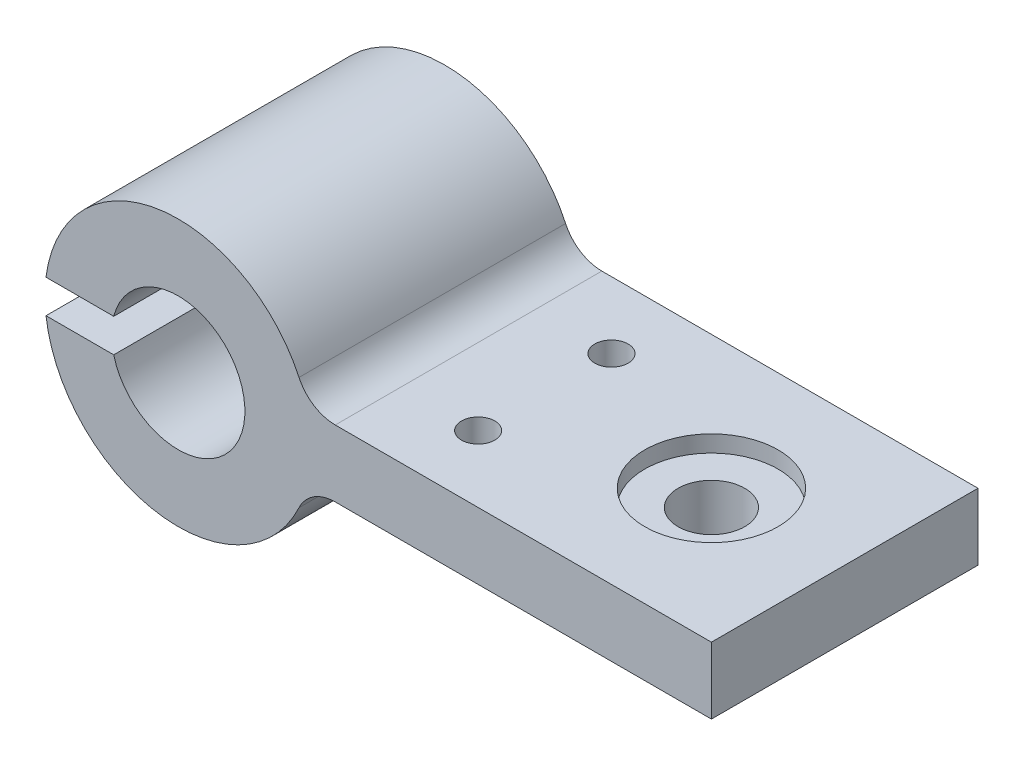
from build123d import *

# Parameters (mm, degrees)
BOSS_EXTRUDE2_DEPTH     = 50.8
SKETCH2_R               = 12.7
CUT_EXTRUDE1_DEPTH      = 3.175
SKETCH3_R               = 6.35
CUT_EXTRUDE2_DEPTH      = 118.131253835
CUT_EXTRUDE3_DEPTH      = 117.397422652
CUT_EXTRUDE3_DEPTH_BACK = 117.397422652
SKETCH5_R               = 3.175
CUT_EXTRUDE4_DEPTH      = 118.946015193


with BuildPart() as part:
    # Sketch1 → Boss-Extrude2 (new body)
    with BuildSketch(Plane.XY):
        with BuildLine():
            Line((29.919216233, -6.35), (24.593444248, -6.35))
            ThreePointArc((24.593444248, -6.35), (23.905382985, -8.584443158), (23.014781645, -10.746154003))
            ThreePointArc((23.014781645, -10.746154003), (25.826619655, -7.542321317), (29.919216233, -6.35))
        make_face()
        with BuildLine():
            ThreePointArc((23.01478179, 10.746153692), (23.905383043, 8.584442996), (24.593444248, 6.35))
            Line((24.593444248, 6.35), (29.919216228, 6.35))
            ThreePointArc((29.919216228, 6.35), (25.826619797, 7.542321227), (23.01478179, 10.746153692))
        make_face()
        with BuildLine():
            Line((29.919216228, 6.35), (24.593444248, 6.35))
            ThreePointArc((24.593444248, 6.35), (25.197554285, 3.200509029), (25.4, 0))
            ThreePointArc((25.4, 0), (25.197554285, -3.200509029), (24.593444248, -6.35))
            Line((24.593444248, -6.35), (29.919216233, -6.35))
            Line((29.919216233, -6.35), (101.6, -6.35))
            Line((101.6, -6.35), (101.6, 6.35))
            Line((101.6, 6.35), (29.919216228, 6.35))
        make_face()
        with BuildLine():
            Line((24.593444248, -6.35), (0, -6.35))
            Line((0, -6.35), (0, -25.4))
            ThreePointArc((0, -25.4), (13.641988278, -21.425595811), (23.014781645, -10.746154003))
            ThreePointArc((23.014781645, -10.746154003), (23.905382985, -8.584443158), (24.593444248, -6.35))
        make_face()
        with BuildLine():
            Line((24.593444248, 6.35), (0, 6.35))
            Line((0, 6.35), (0, -6.35))
            Line((0, -6.35), (24.593444248, -6.35))
            ThreePointArc((24.593444248, -6.35), (25.197554285, -3.200509029), (25.4, 0))
            ThreePointArc((25.4, 0), (25.197554285, 3.200509029), (24.593444248, 6.35))
        make_face()
        with BuildLine():
            Line((0, 25.4), (0, 6.35))
            Line((0, 6.35), (24.593444248, 6.35))
            ThreePointArc((24.593444248, 6.35), (23.905383043, 8.584442996), (23.01478179, 10.746153692))
            ThreePointArc((23.01478179, 10.746153692), (13.641988422, 21.425595718), (0, 25.4))
        make_face()
        with BuildLine():
            Line((0, -6.35), (0, 6.35))
            Line((0, 6.35), (0, 25.4))
            ThreePointArc((0, 25.4), (-25.4, 0), (0, -25.4))
            Line((0, -25.4), (0, -6.35))
        make_face()
    extrude(amount=BOSS_EXTRUDE2_DEPTH)

    # Sketch2 → Cut-Extrude1 (cut)
    with BuildSketch(Plane(origin=(0, 6.35, 0), x_dir=(1, 0, 0), z_dir=(0, 1, 0))):
        with Locations(Location((76.2, -25.4, 0), (0, 0, 270))):
            Circle(SKETCH2_R)
    extrude(amount=-CUT_EXTRUDE1_DEPTH, mode=Mode.SUBTRACT)

    # Sketch3 → Cut-Extrude2 (cut, through all)
    with BuildSketch(Plane(origin=(0, 3.175, 0), x_dir=(1, 0, 0), z_dir=(0, 1, 0))):
        with Locations(Location((76.2, -25.4, 0), (0, 0, 270))):
            Circle(SKETCH3_R)
    extrude(amount=-CUT_EXTRUDE2_DEPTH, mode=Mode.SUBTRACT)

    # Sketch4 → Cut-Extrude3 (cut, two sides: drawn at the far end of the back side and taken through both)
    with BuildSketch(Plane.XY.offset(50.8).offset(-CUT_EXTRUDE3_DEPTH_BACK)):
        with BuildLine():
            Line((-12.296722124, 3.175), (-25.200781238, 3.175))
            ThreePointArc((-25.200781238, 3.175), (-25.350146385, 1.590621979), (-25.4, 0))
            ThreePointArc((-25.4, 0), (-25.350146385, -1.590621979), (-25.200781238, -3.175))
            Line((-25.200781238, -3.175), (-12.296722124, -3.175))
            ThreePointArc((-12.296722124, -3.175), (-12.7, 0), (-12.296722124, 3.175))
        make_face()
        with BuildLine():
            ThreePointArc((12.7, 0), (1.600254515, 12.598777143), (-12.296722124, 3.175))
            Line((-12.296722124, 3.175), (0, 3.175))
            Line((0, 3.175), (0, -3.175))
            Line((0, -3.175), (-12.296722124, -3.175))
            ThreePointArc((-12.296722124, -3.175), (1.600254515, -12.598777143), (12.7, 0))
        make_face()
        with BuildLine():
            Line((0, 3.175), (-12.296722124, 3.175))
            ThreePointArc((-12.296722124, 3.175), (-12.7, 0), (-12.296722124, -3.175))
            Line((-12.296722124, -3.175), (0, -3.175))
            Line((0, -3.175), (0, 3.175))
        make_face()
    extrude(amount=CUT_EXTRUDE3_DEPTH + CUT_EXTRUDE3_DEPTH_BACK, mode=Mode.SUBTRACT)

    # Sketch5 → Cut-Extrude4 (cut, through all)
    with BuildSketch(Plane(origin=(0, 6.35, 0), x_dir=(1, 0, 0), z_dir=(0, 1, 0))):
        with Locations(Location((44.45, -12.7, 0), (0, 0, 270))):
            Circle(SKETCH5_R)
        with Locations(Location((44.45, -38.1, 0), (0, 0, 270))):
            Circle(SKETCH5_R)
    extrude(amount=-CUT_EXTRUDE4_DEPTH, mode=Mode.SUBTRACT)


solid = part.part
